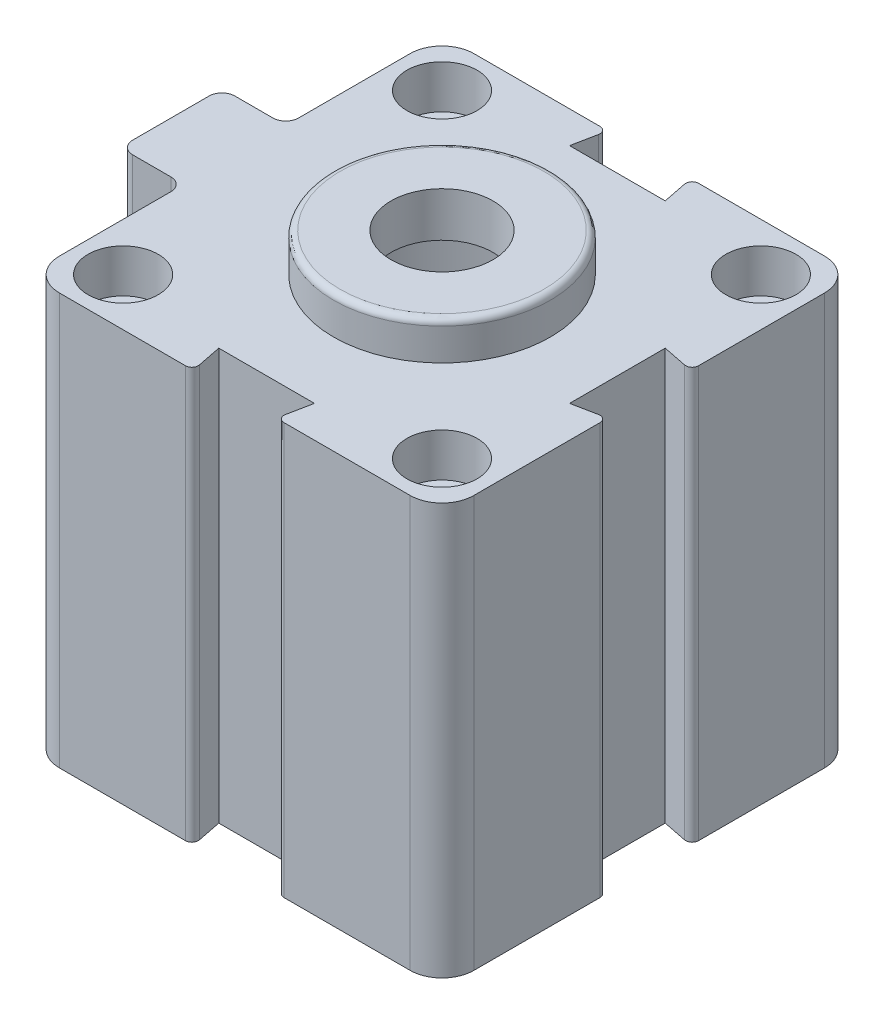
from build123d import *

# Parameters (mm, degrees)
BOSS_EXTRUDE1_DEPTH         = 32.25
SKETCH2_R                   = 5.5
CUT_EXTRUDE1_DEPTH          = 6.8
LPATTERN1_COUNT             = 2
LPATTERN1_PITCH             = 50
LPATTERN1_COUNT_DIR2        = 2
LPATTERN1_PITCH_DIR2        = 50
MIRROR1_COPY_1_SKETCH_R     = 5.5
MIRROR1_COPY_1_DEPTH        = 6.8
MIRROR1_COPY_2_SKETCH_R     = 5.5
MIRROR1_COPY_2_DEPTH        = 6.8
MIRROR1_COPY_3_SKETCH_R     = 5.5
MIRROR1_COPY_3_DEPTH        = 6.8
SKETCH3_R                   = 3.3
CUT_EXTRUDE2_DEPTH          = 63.8
LPATTERN2_COUNT             = 2
LPATTERN2_PITCH             = 50
LPATTERN2_COUNT_DIR2        = 2
LPATTERN2_PITCH_DIR2        = 50
M10X1_25_TAPPED_HOLE1_D     = 8.8
M10X1_25_TAPPED_HOLE1_DEPTH = 10
M10X1_25_TAPPED_HOLE1_TIP   = 2.643786724
SKETCH6_R                   = 25
CUT_EXTRUDE4_DEPTH          = 60
SKETCH7_R                   = 0.6
SKETCH7_R_2                 = 1
CUT_EXTRUDE5_DEPTH          = 26
FILLET1_R                   = 5
FILLET2_R                   = 2
FILLET3_R                   = 1
SKETCH8_R                   = 17
BOSS_EXTRUDE2_DEPTH         = 6
SKETCH9_R                   = 25
BOSS_EXTRUDE3_DEPTH         = 1
FILLET5_R                   = 1
CUT_EXTRUDE6_DEPTH          = 87
CUT_EXTRUDE6_DEPTH_BACK     = 38
SKETCH10_R                  = 8


with BuildPart() as part:
    # Sketch1 → Boss-Extrude1 (new, symmetric)
    with BuildSketch(Plane(origin=(0, 0, 0), x_dir=(1, 0, 0), z_dir=(0, 1, 0))):
        Polygon((-32.5, 32.5), (-7.5, 32.5), (-6.5, 32.5), (-7.5, 27.5), (7.5, 27.5), (6.5, 32.5), (7.5, 32.5), (32.5, 32.5), (32.5, 7.5), (32.5, 6.5), (27.5, 7.5), (27.5, -7.5), (32.5, -6.5), (32.5, -7.5), (32.5, -32.5), (7.5, -32.5), (6.5, -32.5), (7.5, -27.5), (-7.5, -27.5), (-6.5, -32.5), (-7.5, -32.5), (-32.5, -32.5), (-32.5, -8), (-42.5, -8), (-42.5, 8), (-32.5, 8), align=None)
    extrude(amount=BOSS_EXTRUDE1_DEPTH, both=True)

    # Sketch2 → Cut-Extrude1 (cut)
    with BuildSketch(Plane(origin=(0, 32.25, 0), x_dir=(1, 0, 0), z_dir=(0, 1, 0))):
        with Locations(Location((-25, 25, 0), (0, 0, 270))):
            Circle(SKETCH2_R)
    cut_extrude1 = extrude(amount=-CUT_EXTRUDE1_DEPTH, mode=Mode.SUBTRACT)

    # LPattern1: Cut-Extrude1 2 × 2
    with Locations(*[(i * LPATTERN1_PITCH, 0, j * LPATTERN1_PITCH_DIR2) for i in range(LPATTERN1_COUNT) for j in range(LPATTERN1_COUNT_DIR2) if (i, j) != (0, 0)]):
        add(cut_extrude1, mode=Mode.SUBTRACT)

    # Mirror1: Cut-Extrude1 across plane
    add(cut_extrude1.mirror(Plane.ZX), mode=Mode.SUBTRACT)

    # Mirror1 copy 1 sketch → Mirror1 copy 1 (cut)
    with BuildSketch(Plane(origin=(0, -32.25, 50), x_dir=(1, 0, 0), z_dir=(0, -1, 0))):
        with Locations((-25, -25)):
            Circle(MIRROR1_COPY_1_SKETCH_R)
    extrude(amount=-MIRROR1_COPY_1_DEPTH, mode=Mode.SUBTRACT)

    # Mirror1 copy 2 sketch → Mirror1 copy 2 (cut)
    with BuildSketch(Plane(origin=(50, -32.25, 0), x_dir=(1, 0, 0), z_dir=(0, -1, 0))):
        with Locations((-25, -25)):
            Circle(MIRROR1_COPY_2_SKETCH_R)
    extrude(amount=-MIRROR1_COPY_2_DEPTH, mode=Mode.SUBTRACT)

    # Mirror1 copy 3 sketch → Mirror1 copy 3 (cut)
    with BuildSketch(Plane(origin=(50, -32.25, 50), x_dir=(1, 0, 0), z_dir=(0, -1, 0))):
        with Locations((-25, -25)):
            Circle(MIRROR1_COPY_3_SKETCH_R)
    extrude(amount=-MIRROR1_COPY_3_DEPTH, mode=Mode.SUBTRACT)

    # Sketch3 → Cut-Extrude2 (cut)
    with BuildSketch(Plane(origin=(0, 32.25, 0), x_dir=(1, 0, 0), z_dir=(0, 1, 0))):
        with Locations(Location((-25, 25, 0), (0, 0, 270))):
            Circle(SKETCH3_R)
    cut_extrude2 = extrude(amount=-CUT_EXTRUDE2_DEPTH, mode=Mode.SUBTRACT)

    # LPattern2: Cut-Extrude2 2 × 2
    with Locations(*[(i * LPATTERN2_PITCH, 0, j * LPATTERN2_PITCH_DIR2) for i in range(LPATTERN2_COUNT) for j in range(LPATTERN2_COUNT_DIR2) if (i, j) != (0, 0)]):
        add(cut_extrude2, mode=Mode.SUBTRACT)

    # M10x1.25 Tapped Hole1
    with Locations(Plane.ZY.offset(42.5)):
        with Locations((0, -21.25), (0, 14.25)):
            Hole(M10X1_25_TAPPED_HOLE1_D / 2, depth=M10X1_25_TAPPED_HOLE1_DEPTH)
            with Locations((0, 0, -(M10X1_25_TAPPED_HOLE1_DEPTH + M10X1_25_TAPPED_HOLE1_TIP / 2))):  # 118° drill point
                Cone(0, M10X1_25_TAPPED_HOLE1_D / 2, M10X1_25_TAPPED_HOLE1_TIP, mode=Mode.SUBTRACT)

    # Sketch6 → Cut-Extrude4 (cut)
    with BuildSketch(Plane(origin=(0, 32.25, 0), x_dir=(1, 0, 0), z_dir=(0, 1, 0))):
        with Locations(Location((0, 0, 0), (0, 0, 270))):
            Circle(SKETCH6_R)
    extrude(amount=-CUT_EXTRUDE4_DEPTH, mode=Mode.SUBTRACT)

    # Sketch7 → Cut-Extrude5 (cut)
    with BuildSketch(Plane.ZY.offset(42.5)):
        with Locations((-1.046113874, 15.75709023)):
            Circle(SKETCH7_R)
        with Locations((-1.046113874, -20.009379673)):
            Circle(SKETCH7_R_2)
    extrude(amount=-CUT_EXTRUDE5_DEPTH, mode=Mode.SUBTRACT)

    # Fillet1
    fillet1_edges = [part.edges().sort_by_distance(p)[0] for p in [
        (32.5, 0, 32.5),
        (-32.5, 0, 32.5),
        (-32.5, 0, -32.5),
        (32.5, 0, -32.5),
    ]]
    fillet(fillet1_edges, radius=FILLET1_R)

    # Fillet2
    fillet2_edges = [part.edges().sort_by_distance(p)[0] for p in [
        (-32.5, 0, 8),
        (-42.5, 0, 8),
        (-42.5, 0, -8),
        (-32.5, 0, -8),
    ]]
    fillet(fillet2_edges, radius=FILLET2_R)

    # Fillet3
    fillet3_edges = [part.edges().sort_by_distance(p)[0] for p in [
        (6.5, 0, 32.5),
        (-6.5, 0, 32.5),
        (-6.5, 0, -32.5),
        (6.5, 0, -32.5),
        (32.5, 0, -6.5),
        (32.5, 0, 6.5),
    ]]
    fillet(fillet3_edges, radius=FILLET3_R)



with BuildPart() as body_2:
    # Sketch8 → Boss-Extrude2 (new body)
    with BuildSketch(Plane(origin=(0, 32.25, 0), x_dir=(1, 0, 0), z_dir=(0, 1, 0))):
        with Locations(Location((0, 0, 0), (0, 0, 270))):
            Circle(SKETCH8_R)
    extrude(amount=BOSS_EXTRUDE2_DEPTH)


with BuildPart() as part_1:
    add(part.part)

    add(body_2.part)  # Boss-Extrude3 merges body 2
    # Sketch9 → Boss-Extrude3 (add)
    with BuildSketch(Plane(origin=(0, 32.25, 0), x_dir=(1, 0, 0), z_dir=(0, 1, 0))):
        with Locations(Location((0, 0, 0), (0, 0, 270))):
            Circle(SKETCH9_R)
    extrude(amount=-BOSS_EXTRUDE3_DEPTH)

    # Fillet5
    fillet5_edges = [part_1.edges().sort_by_distance(p)[0] for p in [
        (0, 38.25, -17),
    ]]
    fillet(fillet5_edges, radius=FILLET5_R)

    # Sketch10 → Cut-Extrude6 (cut, two sides: drawn at the far end of the back side and taken through both)
    with BuildSketch(Plane(origin=(0, 38.25, 0), x_dir=(1, 0, 0), z_dir=(0, 1, 0)).offset(-CUT_EXTRUDE6_DEPTH_BACK)):
        with Locations(Location((0, 0, 0), (0, 0, 270))):
            Circle(SKETCH10_R)
    extrude(amount=CUT_EXTRUDE6_DEPTH + CUT_EXTRUDE6_DEPTH_BACK, mode=Mode.SUBTRACT)


solid = part_1.part
